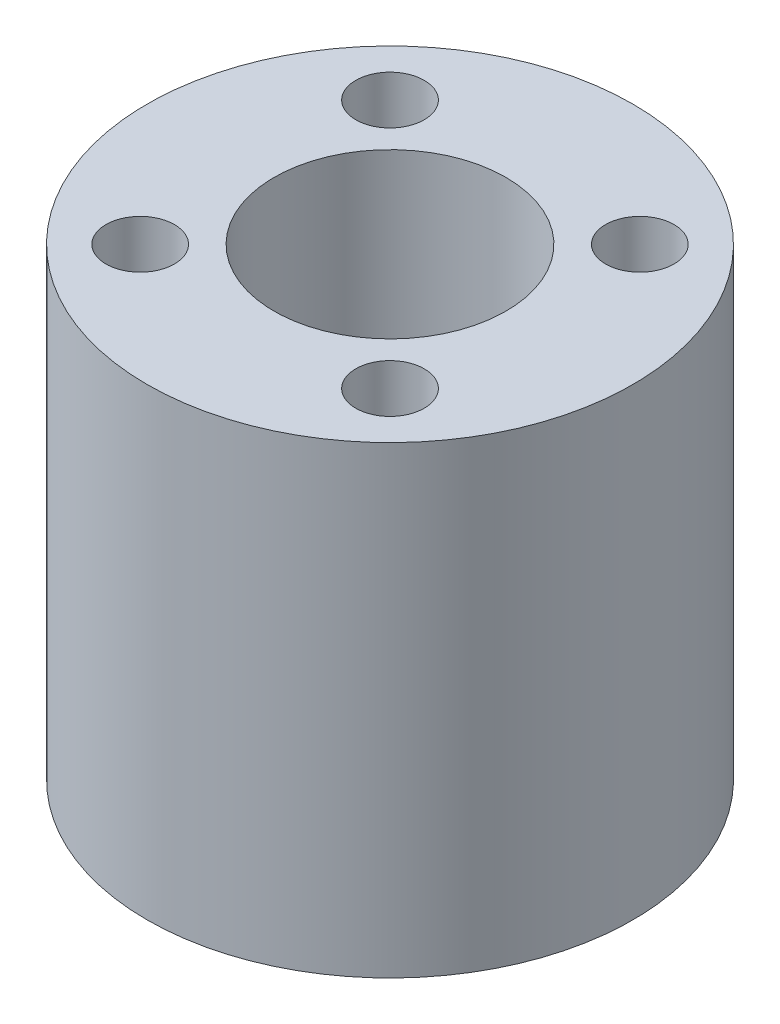
from build123d import *

# Parameters (mm, degrees)
CROQUIS1_R              = 11
CROQUIS1_R_2            = 5.25
CROQUIS1_R_3            = 1.55
SALIENTE_EXTRUIR1_DEPTH = 21


with BuildPart() as part:
    # Croquis1 → Saliente-Extruir1 (new body)
    with BuildSketch(Plane(origin=(0, 0, 0), x_dir=(1, 0, 0), z_dir=(0, 1, 0))):
        with Locations(Location((0, 0, 0), (0, 0, 90))):
            Circle(CROQUIS1_R)
        with Locations(Location((0, 0, 0), (0, 0, 90))):
            Circle(CROQUIS1_R_2, mode=Mode.SUBTRACT)
        with Locations(Location((5.656854249, 5.656854249, 0), (0, 0, 90))):
            Circle(CROQUIS1_R_3, mode=Mode.SUBTRACT)
        with Locations(Location((-5.656854249, 5.656854249, 0), (0, 0, 90))):
            Circle(CROQUIS1_R_3, mode=Mode.SUBTRACT)
        with Locations(Location((-5.656854249, -5.656854249, 0), (0, 0, 90))):
            Circle(CROQUIS1_R_3, mode=Mode.SUBTRACT)
        with Locations(Location((5.656854249, -5.656854249, 0), (0, 0, 90))):
            Circle(CROQUIS1_R_3, mode=Mode.SUBTRACT)
    extrude(amount=SALIENTE_EXTRUIR1_DEPTH)


solid = part.part
